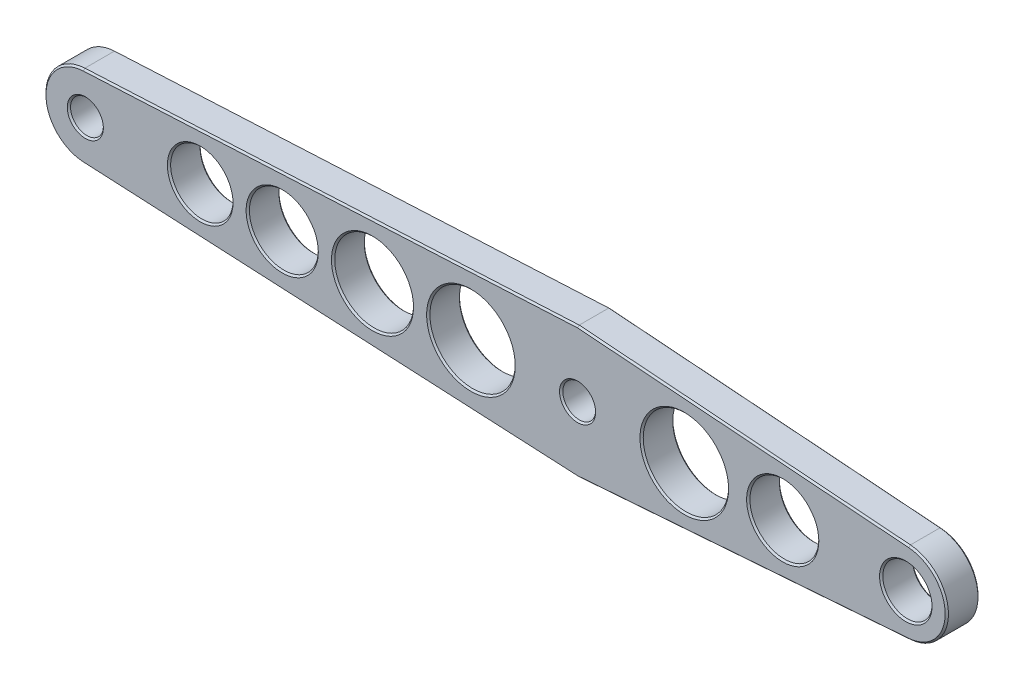
from build123d import *

# Parameters (mm, degrees)
SKETCH1_R           = 1
SKETCH1_R_2         = 1.9
SKETCH1_R_3         = 2.1
SKETCH1_R_4         = 2.4
SKETCH1_R_5         = 1.5
SKETCH1_R_6         = 2.6
BOSS_EXTRUDE1_DEPTH = 2
CHAMFER1_SIZE       = 0.1


with BuildPart() as part:
    # Sketch1 → Boss-Extrude1 (new body)
    with BuildSketch(Plane.XY):
        with BuildLine():
            Line((-30.124585833, 2.496893744), (0, 4))
            Line((0, 4), (20.18611256, 2.493062798))
            ThreePointArc((20.18611256, 2.493062798), (22.5, 0), (20.18611256, -2.493062798))
            Line((20.18611256, -2.493062798), (0, -4))
            Line((0, -4), (-30.124585833, -2.496893744))
            ThreePointArc((-30.124585833, -2.496893744), (-32.5, 0), (-30.124585833, 2.496893744))
        make_face()
        with Locations((-30, 0)):
            Circle(SKETCH1_R, mode=Mode.SUBTRACT)
        with Locations((-23, 0)):
            Circle(SKETCH1_R_2, mode=Mode.SUBTRACT)
        with Locations((-18, 0)):
            Circle(SKETCH1_R_3, mode=Mode.SUBTRACT)
        with Locations((-12.5, 0)):
            Circle(SKETCH1_R_4, mode=Mode.SUBTRACT)
        Circle(SKETCH1_R, mode=Mode.SUBTRACT)
        with Locations((20, 0)):
            Circle(SKETCH1_R_5, mode=Mode.SUBTRACT)
        with Locations((-6.5, 0)):
            Circle(SKETCH1_R_6, mode=Mode.SUBTRACT)
        with Locations((6.5, 0)):
            Circle(SKETCH1_R_6, mode=Mode.SUBTRACT)
        with Locations((12.5, 0)):
            Circle(SKETCH1_R_3, mode=Mode.SUBTRACT)
    extrude(amount=BOSS_EXTRUDE1_DEPTH)

    # Chamfer1
    chamfer1_edges = [part.edges().sort_by_distance(p)[0] for p in [
        (10.09305628, -3.246531399, 2),
        (22.5, 0, 2),
        (-31, 0, 0),
        (-31, 0, 2),
        (-24.9, 0, 0),
        (10.09305628, 3.246531399, 2),
        (-24.9, 0, 2),
        (-20.1, 0, 0),
        (-15.062292916, 3.248446872, 2),
        (-20.1, 0, 2),
        (-14.9, 0, 0),
        (-14.9, 0, 2),
        (-1, 0, 0),
        (-1, 0, 2),
        (18.5, 0, 0),
        (18.5, 0, 2),
        (-9.1, 0, 0),
        (-9.1, 0, 2),
        (10.4, 0, 0),
        (10.4, 0, 2),
        (3.9, 0, 0),
        (3.9, 0, 2),
        (-32.5, 0, 2),
        (-15.062292916, 3.248446872, 0),
        (10.09305628, 3.246531399, 0),
        (22.5, 0, 0),
        (10.09305628, -3.246531399, 0),
        (-15.062292916, -3.248446872, 0),
        (-32.5, 0, 0),
        (-15.062292916, -3.248446872, 2),
    ]]
    chamfer(chamfer1_edges, length=CHAMFER1_SIZE)


solid = part.part
